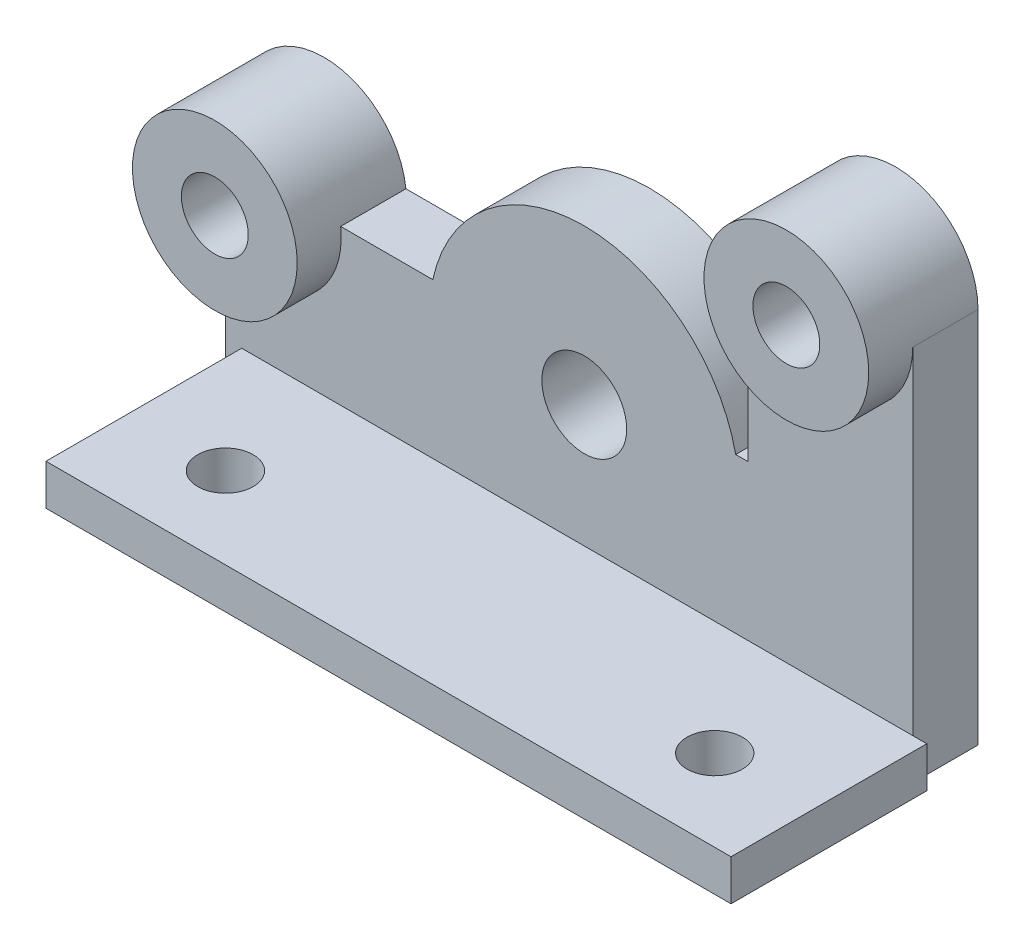
from build123d import *

# Parameters (mm, degrees)
SKETCH1_W           = 41
SKETCH1_H           = 12
BOSS_EXTRUDE1_DEPTH = 4
SKETCH2_R           = 9.5
SKETCH2_R_2         = 2.6
BOSS_EXTRUDE2_DEPTH = 4
SKETCH3_R           = 5.05
BOSS_EXTRUDE3_DEPTH = 4
SKETCH4_R           = 5.05
BOSS_EXTRUDE4_DEPTH = 4
SKETCH5_W           = 10.1
SKETCH5_H           = 23.124939501
BOSS_EXTRUDE5_DEPTH = 4
SKETCH6_W           = 42
SKETCH6_H           = 12
SKETCH6_R           = 1.7
BOSS_EXTRUDE6_DEPTH = 2.5
SKETCH7_R           = 2.6
CUT_EXTRUDE1_DEPTH  = 4
SKETCH8_R           = 5.05
BOSS_EXTRUDE7_DEPTH = 2.7
SKETCH9_R           = 2.05
CUT_EXTRUDE2_DEPTH  = 6.7


with BuildPart() as part:
    # Sketch1 → Boss-Extrude1 (new body)
    with BuildSketch(Plane.XY.offset(358.5)):
        with Locations((298.5, 36)):
            Rectangle(SKETCH1_W, SKETCH1_H)
    extrude(amount=BOSS_EXTRUDE1_DEPTH)

    # Sketch2 → Boss-Extrude2 (add)
    with BuildSketch(Plane.XY.offset(358.5)):
        with Locations((300, 40)):
            Circle(SKETCH2_R)
        with Locations((300, 40)):
            Circle(SKETCH2_R_2, mode=Mode.SUBTRACT)
    extrude(amount=BOSS_EXTRUDE2_DEPTH)

    # Sketch4 → Boss-Extrude4 (add)
    with BuildSketch(Plane.XY.offset(358.5)):
        with Locations((280.050647312, 41.422437104)):
            Circle(SKETCH4_R)
    extrude(amount=BOSS_EXTRUDE4_DEPTH)



with BuildPart() as body_2:
    # Sketch3 → Boss-Extrude3 (new body)
    with BuildSketch(Plane.XY.offset(358.5)):
        with Locations((315.090923202, 53.124939501)):
            Circle(SKETCH3_R)
    extrude(amount=BOSS_EXTRUDE3_DEPTH)


with BuildPart() as part_1:
    add(part.part)

    add(body_2.part)  # Boss-Extrude5 merges body 2
    # Sketch5 → Boss-Extrude5 (add)
    with BuildSketch(Plane.XY.offset(358.5)):
        with Locations((315.090923202, 41.562469751)):
            Rectangle(SKETCH5_W, SKETCH5_H)
    extrude(amount=BOSS_EXTRUDE5_DEPTH)

    # Sketch6 → Boss-Extrude6 (add)
    with BuildSketch(Plane(origin=(0, 30, 0), x_dir=(1, 0, 0), z_dir=(0, 1, 0))):
        with Locations((300, -368.5)):
            Rectangle(SKETCH6_W, SKETCH6_H)
        with Locations((285, -369.5)):
            Circle(SKETCH6_R, mode=Mode.SUBTRACT)
        with Locations((315, -369.5)):
            Circle(SKETCH6_R, mode=Mode.SUBTRACT)
    extrude(amount=BOSS_EXTRUDE6_DEPTH)

    # Sketch7 → Cut-Extrude1 (cut)
    with BuildSketch(Plane.XY.offset(358.5)):
        with Locations((300, 40)):
            Circle(SKETCH7_R)
    extrude(amount=CUT_EXTRUDE1_DEPTH, mode=Mode.SUBTRACT)

    # Sketch8 → Boss-Extrude7 (add)
    with BuildSketch(Plane.XY.offset(362.5)):
        with Locations((315.090923202, 53.124939501)):
            Circle(SKETCH8_R)
        with Locations((280.050647312, 41.422437104)):
            Circle(SKETCH8_R)
    extrude(amount=BOSS_EXTRUDE7_DEPTH)

    # Sketch9 → Cut-Extrude2 (cut)
    with BuildSketch(Plane.XY.offset(358.5)):
        with Locations((315.090923202, 53.124939501)):
            Circle(SKETCH9_R)
        with Locations((280.050647312, 41.422437104)):
            Circle(SKETCH9_R)
    extrude(amount=CUT_EXTRUDE2_DEPTH, mode=Mode.SUBTRACT)


solid = part_1.part
